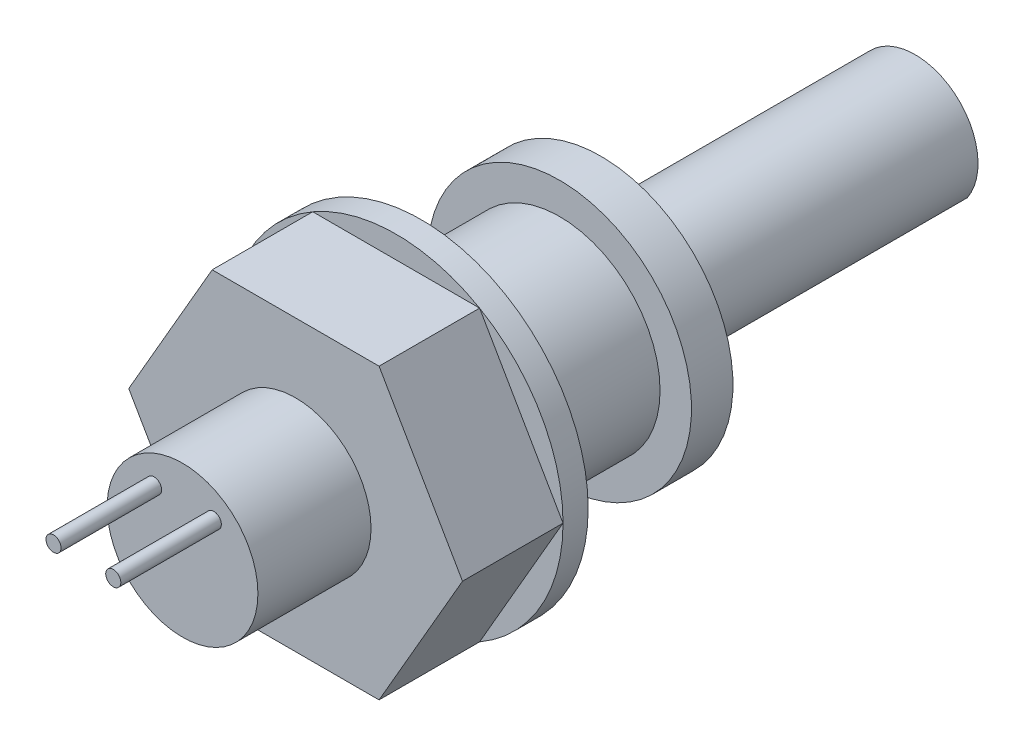
from build123d import *

# Parameters (mm, degrees)
RESSALTO_EXTRUS_O1_DEPTH = 8
ESBO_O2_R                = 6
RESSALTO_EXTRUS_O2_DEPTH = 9
ESBO_O3_R                = 8
RESSALTO_EXTRUS_O3_DEPTH = 13
ESBO_O4_R                = 10.5
RESSALTO_EXTRUS_O4_DEPTH = 3.3
RESSALTO_EXTRUS_O6_DEPTH = 25
ESBO_O6_R                = 13.279056191
RESSALTO_EXTRUS_O7_DEPTH = 2
ESBO_O7_R                = 0.6
RESSALTO_EXTRUS_O8_DEPTH = 8


with BuildPart() as part:
    # Esboço1 → Ressalto-extrusão1 (new body)
    with BuildSketch(Plane.XY):
        Polygon((6.639528096, -11.5), (13.279056191, 0), (6.639528096, 11.5), (-6.639528096, 11.5), (-13.279056191, 0), (-6.639528096, -11.5), align=None)
    extrude(amount=RESSALTO_EXTRUS_O1_DEPTH)

    # Esboço2 → Ressalto-extrusão2 (add)
    with BuildSketch(Plane.XY.offset(8)):
        Circle(ESBO_O2_R)
    extrude(amount=RESSALTO_EXTRUS_O2_DEPTH)

    # Esboço3 → Ressalto-extrusão3 (add)
    with BuildSketch(Plane(origin=(0, 0, 0), x_dir=(-1, 0, 0), z_dir=(0, 0, -1))):
        with Locations(Location((0, 0, 0), (0, 0, 180))):
            Circle(ESBO_O3_R)
    extrude(amount=RESSALTO_EXTRUS_O3_DEPTH)

    # Esboço4 → Ressalto-extrusão4 (add)
    with BuildSketch(Plane(origin=(0, 0, -13), x_dir=(-1, 0, 0), z_dir=(0, 0, -1))):
        Circle(ESBO_O4_R)
    extrude(amount=RESSALTO_EXTRUS_O4_DEPTH)

    # Esboço5 → Ressalto-extrusão6 (add)
    with BuildSketch(Plane(origin=(0, 0, -16.3), x_dir=(-1, 0, 0), z_dir=(0, 0, -1))):
        with BuildLine():
            Line((-4.148096191, -2.791647899), (4.148096191, -2.791647899))
            ThreePointArc((4.148096191, -2.791647899), (0, 5), (-4.148096191, -2.791647899))
        make_face()
    extrude(amount=RESSALTO_EXTRUS_O6_DEPTH)

    # Esboço6 → Ressalto-extrusão7 (add)
    with BuildSketch(Plane(origin=(0, 0, 0), x_dir=(-1, 0, 0), z_dir=(0, 0, -1))):
        Circle(ESBO_O6_R)
    extrude(amount=RESSALTO_EXTRUS_O7_DEPTH)

    # Esboço7 → Ressalto-extrusão8 (add)
    with BuildSketch(Plane.XY.offset(17)):
        with Locations((-2.263806511, 3.320249549)):
            Circle(ESBO_O7_R)
        with Locations((2.490187162, 3.320249549)):
            Circle(ESBO_O7_R)
    extrude(amount=RESSALTO_EXTRUS_O8_DEPTH)


solid = part.part
